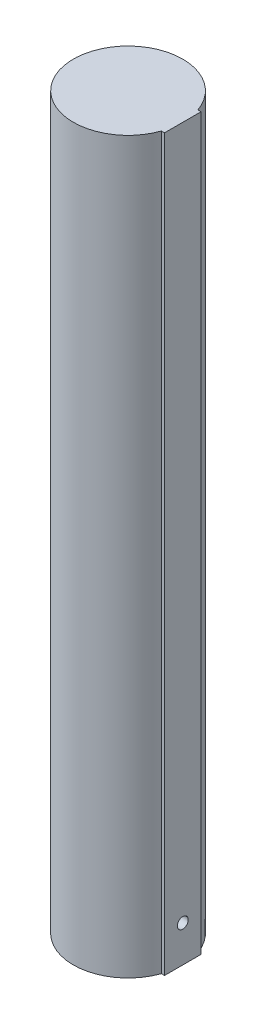
from build123d import *

# Parameters (mm, degrees)
SKETCH1_R           = 15
BOSS_EXTRUDE1_DEPTH = 200
SKETCH2_W           = 0.857864376
SKETCH2_H           = 10
BOSS_EXTRUDE2_DEPTH = 200
CUT_EXTRUDE1_DEPTH  = 25
SKETCH4_R           = 1.5
CUT_EXTRUDE2_DEPTH  = 15


with BuildPart() as part:
    # Sketch1 → Boss-Extrude1 (new body)
    with BuildSketch(Plane(origin=(0, 0, 0), x_dir=(1, 0, 0), z_dir=(0, 1, 0))):
        with Locations(Location((0, 0, 0), (0, 0, 270))):
            Circle(SKETCH1_R)
    extrude(amount=BOSS_EXTRUDE1_DEPTH)

    # Sketch2 → Boss-Extrude2 (add)
    with BuildSketch(Plane(origin=(0, 200, 0), x_dir=(1, 0, 0), z_dir=(0, 1, 0))):
        with Locations((14.571067812, 0)):
            Rectangle(SKETCH2_W, SKETCH2_H)
    extrude(amount=-BOSS_EXTRUDE2_DEPTH)

    # Sketch3 → Cut-Extrude1 (cut)
    with BuildSketch(Plane.XZ):
        with BuildLine():
            Line((1.5, -1.322875656), (1.5, 1.322875656))
            ThreePointArc((1.5, 1.322875656), (-2, 0), (1.5, -1.322875656))
        make_face()
    extrude(amount=-CUT_EXTRUDE1_DEPTH, mode=Mode.SUBTRACT)

    # Sketch4 → Cut-Extrude2 (cut)
    with BuildSketch(Plane(origin=(15, 0, 0), x_dir=(0, 0, -1), z_dir=(1, 0, 0))):
        with Locations((0, 10)):
            Circle(SKETCH4_R)
    extrude(amount=-CUT_EXTRUDE2_DEPTH, mode=Mode.SUBTRACT)


solid = part.part
